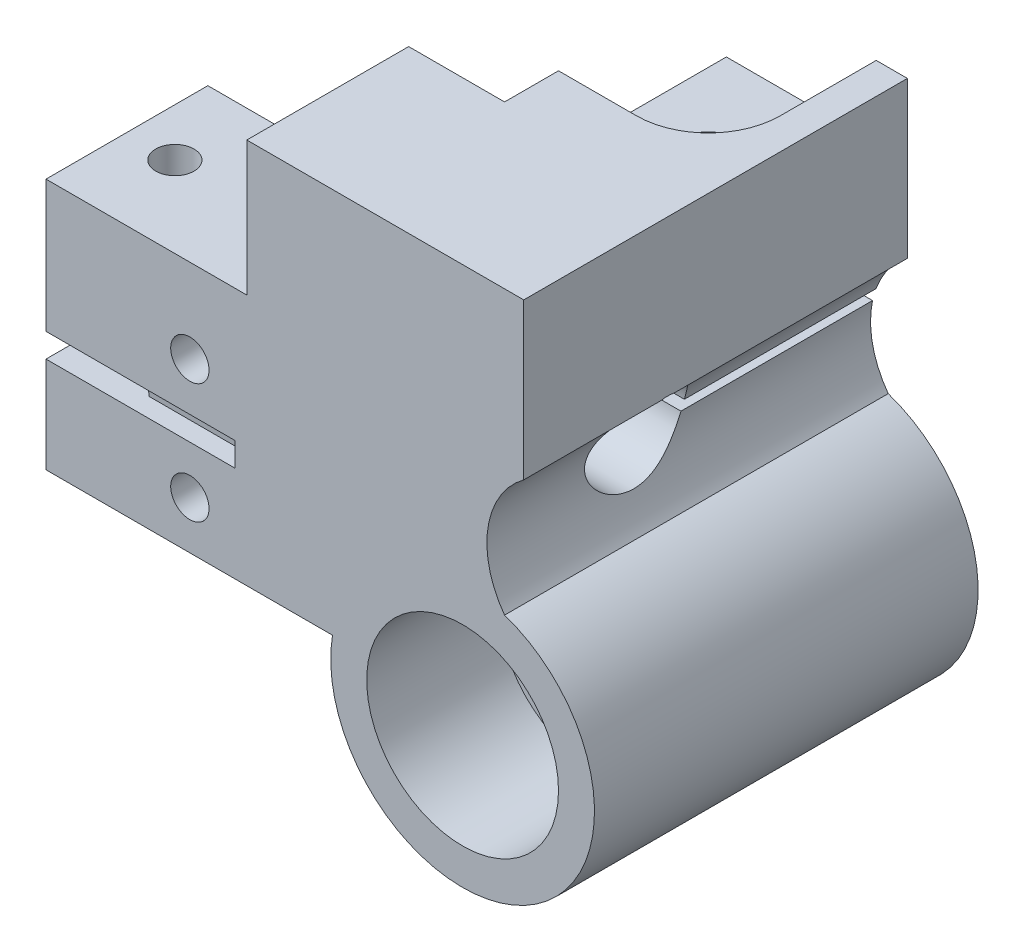
from build123d import *

# Parameters (mm, degrees)
BOSS_EXTRUDE1_DEPTH     = 16
CUT_EXTRUDE1_START      = -18.5
CUT_EXTRUDE1_DEPTH      = 18.5
SKETCH3_R               = 8
CUT_EXTRUDE2_DEPTH      = 11
SKETCH4_R               = 5.75
CUT_EXTRUDE3_DEPTH      = 10
CUT_EXTRUDE4_DEPTH      = 17.5
SKETCH6_R               = 1.6
CUT_EXTRUDE5_DEPTH      = 59.202770608
CUT_EXTRUDE6_REACH      = 53.049
SKETCH7_R               = 1.6
CUT_EXTRUDE7_REACH      = 61.064
CUT_EXTRUDE7_END_RADIUS = 8
SKETCH8_R               = 2.6
CUT_EXTRUDE8_DEPTH      = 6
BOSS_EXTRUDE2_DEPTH     = 7.75
LPATTERN1_COUNT         = 7
LPATTERN1_PITCH         = 2
SKETCH11_W              = 8.2
SKETCH11_H              = 4.2
CUT_EXTRUDE9_DEPTH      = 12.2


with BuildPart() as part:
    # Sketch1 → Boss-Extrude1 (new, symmetric)
    with BuildSketch(Plane.XY):
        with BuildLine():
            Line((5.1, 34), (5.1, 21))
            ThreePointArc((5.1, 21), (2.110534793, 16.045534254), (3.5, 10.428326807))
            ThreePointArc((3.5, 10.428326807), (5.667802213, -9.427407813), (-10.851727973, 1.8))
            Line((-10.851727973, 1.8), (-34.75, 1.8))
            Line((-34.75, 1.8), (-34.75, 9.8))
            Line((-34.75, 9.8), (-19, 9.8))
            Line((-19, 9.8), (-19, 11.8))
            Line((-19, 11.8), (-34.75, 11.8))
            Line((-34.75, 11.8), (-34.75, 22.8))
            Line((-34.75, 22.8), (-18, 22.8))
            Line((-18, 22.8), (-18, 34))
            Line((-18, 34), (5.1, 34))
        make_face()
    extrude(amount=BOSS_EXTRUDE1_DEPTH, both=True)

    # Sketch2 → Cut-Extrude1 (cut)
    with BuildSketch(Plane(origin=(0, 0, -16), x_dir=(-1, 0, 0), z_dir=(0, 0, -1)).offset(CUT_EXTRUDE1_START)):
        with BuildLine():
            Line((18, 34), (10, 34))
            Line((10, 34), (10, 4.582575695))
            ThreePointArc((10, 4.582575695), (10.518285114, 3.219577342), (10.851727973, 1.8))
            Line((10.851727973, 1.8), (34.75, 1.8))
            Line((34.75, 1.8), (34.75, 22.8))
            Line((34.75, 22.8), (18, 22.8))
            Line((18, 22.8), (18, 34))
        make_face()
    extrude(amount=CUT_EXTRUDE1_DEPTH, mode=Mode.SUBTRACT)

    # Sketch3 → Cut-Extrude2 (cut)
    with BuildSketch(Plane.XY.offset(16)):
        Circle(SKETCH3_R)
    cut_extrude2 = extrude(amount=-CUT_EXTRUDE2_DEPTH, mode=Mode.SUBTRACT)

    # Mirror1: Cut-Extrude2 across plane
    add(cut_extrude2.mirror(Plane.XY), mode=Mode.SUBTRACT)

    # Sketch4 → Cut-Extrude3 (cut)
    with BuildSketch(Plane.XY.offset(5)):
        Circle(SKETCH4_R)
    extrude(amount=-CUT_EXTRUDE3_DEPTH, mode=Mode.SUBTRACT)

    # Sketch5 → Cut-Extrude4 (cut)
    with BuildSketch(Plane(origin=(5.1, 0, 0), x_dir=(0, 0, -1), z_dir=(1, 0, 0))):
        with BuildLine():
            Line((16, 17.5), (16, 16.5))
            Line((16, 16.5), (0.019017293, 16.5))
            ThreePointArc((0.019017293, 16.5), (-8.05, 17), (0.019017293, 17.5))
            Line((0.019017293, 17.5), (16, 17.5))
        make_face()
    extrude(amount=-CUT_EXTRUDE4_DEPTH, mode=Mode.SUBTRACT)

    # Sketch6 → Cut-Extrude5 (cut, through all)
    with BuildSketch(Plane.XY.offset(16)):
        with Locations((-22.75, 15.8)):
            Circle(SKETCH6_R)
        with Locations((-22.75, 5.8)):
            Circle(SKETCH6_R)
    extrude(amount=-CUT_EXTRUDE5_DEPTH, mode=Mode.SUBTRACT)

    # Cut-Extrude6: up to this face of the body (flat: up to its plane)
    cut_extrude6_end = Plane(part.part.faces().sort_by_distance((-22.800863987, 1.8, 9.25))[0])
    # Sketch7 → Cut-Extrude6 (cut, up to the picked face)
    with BuildSketch(Plane(origin=(0, 22.8, 0), x_dir=(1, 0, 0), z_dir=(0, 1, 0)), mode=Mode.PRIVATE) as cut_extrude6_sk1:
        with Locations(Location((-30.75, -9.25, 0), (0, 0, 180))):
            Circle(SKETCH7_R)
    cut_extrude6_tool1 = split(extrude(cut_extrude6_sk1.sketch, amount=-CUT_EXTRUDE6_REACH, mode=Mode.PRIVATE), bisect_by=cut_extrude6_end, keep=Keep.BOTH, mode=Mode.PRIVATE)
    add(cut_extrude6_tool1.solids().sort_by(Axis((-30.75, 22.8, 9.25), (0, -1, 0)))[0], mode=Mode.SUBTRACT)

    # Cut-Extrude7: up to this cylinder (the profile starts outside it)
    cut_extrude7_end = Plane(origin=(0, 0, -8), z_dir=(0, 0, -1)) * Cylinder(CUT_EXTRUDE7_END_RADIUS, 139.128, mode=Mode.PRIVATE)
    # Sketch8 → Cut-Extrude7 (cut, up to the surface)
    with BuildSketch(Plane(origin=(0, 34, 0), x_dir=(1, 0, 0), z_dir=(0, 1, 0)), mode=Mode.PRIVATE) as cut_extrude7_sk1:
        with Locations(Location((-3.5, 8, 0), (0, 0, 270))):
            Circle(SKETCH8_R)
    cut_extrude7_tool1 = extrude(cut_extrude7_sk1.sketch, amount=-CUT_EXTRUDE7_REACH, mode=Mode.PRIVATE) - cut_extrude7_end
    add(cut_extrude7_tool1.solids().sort_by_distance((-3.5, 34, -8))[0], mode=Mode.SUBTRACT)

    # Sketch9 → Cut-Extrude8 (cut)
    with BuildSketch(Plane(origin=(0, 34, 0), x_dir=(1, 0, 0), z_dir=(0, 1, 0))):
        with BuildLine():
            Line((2.5, 8), (2.5, 16))
            Line((2.5, 16), (-10, 16))
            Line((-10, 16), (-10, 2))
            Line((-10, 2), (-3.5, 2))
            ThreePointArc((-3.5, 2), (0.742640687, 3.757359313), (2.5, 8))
        make_face()
    extrude(amount=-CUT_EXTRUDE8_DEPTH, mode=Mode.SUBTRACT)

    # Sketch10 → Boss-Extrude2 (add)
    with BuildSketch(Plane.ZY.offset(19)):
        Polygon((2.5, 11.8), (2.6, 10.8), (3.4, 10.8), (3.5, 11.8), align=None)
    boss_extrude2 = extrude(amount=BOSS_EXTRUDE2_DEPTH)

    # LPattern1: Boss-Extrude2 ×7
    with Locations(*[(0, 0, i * LPATTERN1_PITCH) for i in range(1, LPATTERN1_COUNT)]):
        add(boss_extrude2)

    # Sketch11 → Cut-Extrude9 (cut)
    with BuildSketch(Plane(origin=(0, 0, -16), x_dir=(-1, 0, 0), z_dir=(0, 0, -1))):
        with Locations((3.5, 12.4)):
            Rectangle(SKETCH11_W, SKETCH11_H)
    extrude(amount=-CUT_EXTRUDE9_DEPTH, mode=Mode.SUBTRACT)


solid = part.part
